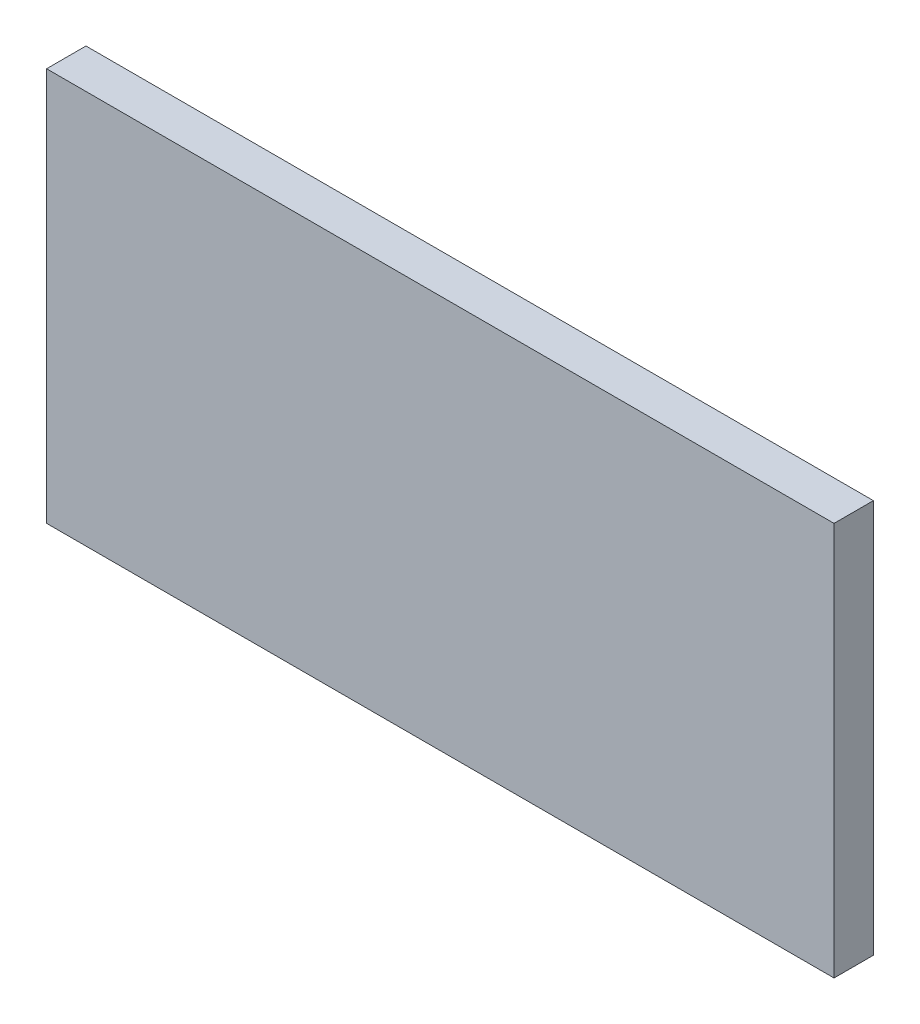
from build123d import *

# Parameters (mm, degrees)
SKETCH1_W      = 50.8
SKETCH1_H      = 25.4
EXTRUDE1_DEPTH = 2.54


with BuildPart() as part:
    # Sketch1 → Extrude1 (new body)
    with BuildSketch(Plane.XY):
        with Locations((25.4, 12.7)):
            Rectangle(SKETCH1_W, SKETCH1_H)
    extrude(amount=EXTRUDE1_DEPTH)


solid = part.part
